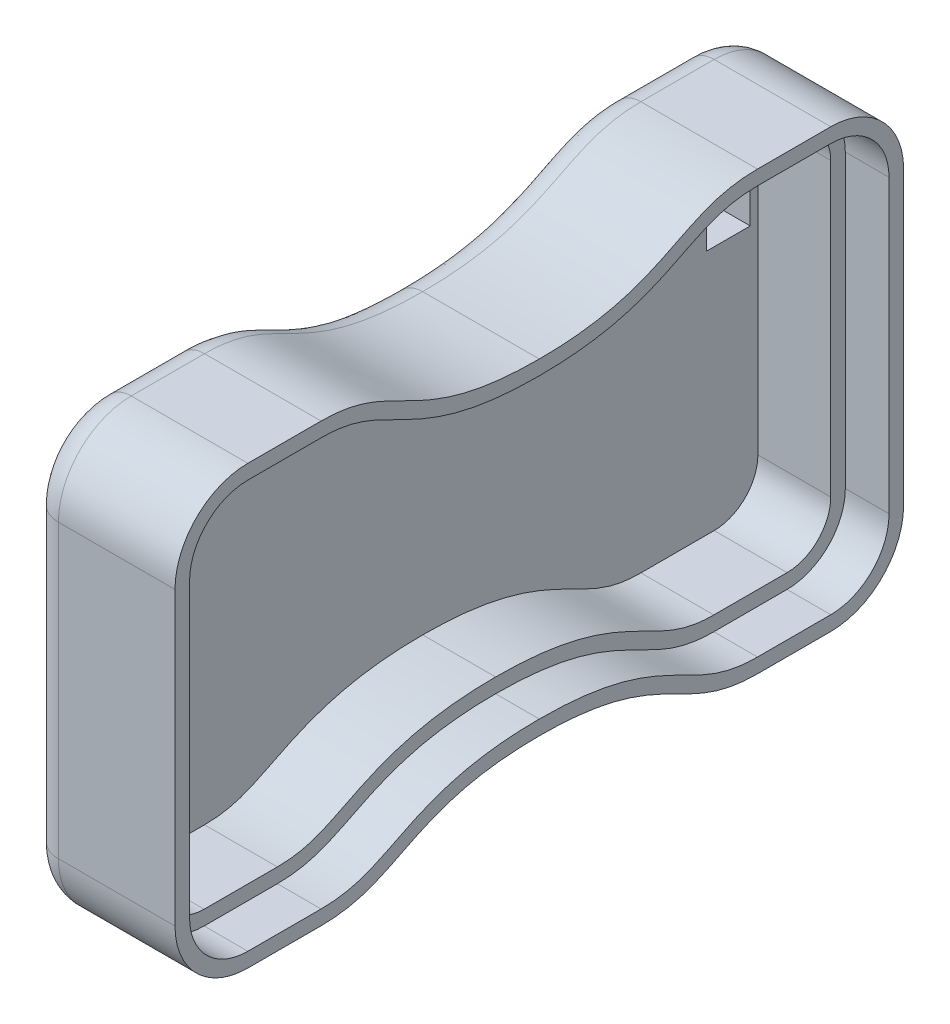
from build123d import *

# Parameters (mm, degrees)
BOSS_EXTRUDE1_DEPTH      = 10
BOSS_EXTRUDE1_DEPTH_BACK = 0.001
CUT_EXTRUDE2_DEPTH       = 8
FILLET1_R                = 2
CUT_EXTRUDE3_DEPTH       = 1
CUT_EXTRUDE4_DEPTH       = 1
CUT_EXTRUDE6_DEPTH       = 3
SKETCH9_W                = 3
SKETCH9_H                = 3
CUT_EXTRUDE7_DEPTH       = 2.5


with BuildPart() as part:
    # Sketch1 → Boss-Extrude1 (new, two sides: drawn at the far end of the back side and taken through both)
    with BuildSketch(Plane(origin=(0, 0, 0), x_dir=(0, 0, -1), z_dir=(1, 0, 0)).offset(-BOSS_EXTRUDE1_DEPTH_BACK)):
        with BuildLine():
            Line((-14.972324225, 15), (-20, 15))
            ThreePointArc((-20, 15), (-23.535533906, 13.535533906), (-25, 10))
            Line((-25, 10), (-25, -10))
            ThreePointArc((-25, -10), (-23.535533906, -13.535533906), (-20, -15))
            Line((-20, -15), (-14.972324225, -15))
            add(Edge.make_bspline(
                [(-14.972324225, -15), (-9.506561261, -15), (-8.88126456, -11.19751344), (0, -11.19751344)],
                knots=[0, 0, 0, 0, 1, 1, 1, 1], degree=3))
            add(Edge.make_bspline(
                [(14.972324225, -15), (9.506561261, -15), (8.88126456, -11.19751344), (0, -11.19751344)],
                knots=[0, 0, 0, 0, 1, 1, 1, 1], degree=3))
            Line((14.972324225, -15), (20, -15))
            ThreePointArc((20, -15), (23.535533906, -13.535533906), (25, -10))
            Line((25, -10), (25, 10))
            ThreePointArc((25, 10), (23.535533906, 13.535533906), (20, 15))
            Line((20, 15), (14.972324225, 15))
            add(Edge.make_bspline(
                [(14.972324225, 15), (9.506561261, 15), (8.88126456, 11.19751344), (0, 11.19751344)],
                knots=[0, 0, 0, 0, 1, 1, 1, 1], degree=3))
            add(Edge.make_bspline(
                [(-14.972324225, 15), (-9.506561261, 15), (-8.88126456, 11.19751344), (0, 11.19751344)],
                knots=[0, 0, 0, 0, 1, 1, 1, 1], degree=3))
        make_face()
    extrude(amount=BOSS_EXTRUDE1_DEPTH + BOSS_EXTRUDE1_DEPTH_BACK)

    # Sketch3 → Cut-Extrude2 (cut)
    with BuildSketch(Plane(origin=(10, 0, 0), x_dir=(0, 0, -1), z_dir=(1, 0, 0))):
        with BuildLine():
            add(Edge.make_bspline(
                [(14.972324225, 13), (14.708537784, 13), (14.155988905, 12.97545839), (13.256726616, 12.846515622), (12.269088092, 12.561695204), (11.07958651, 12.026997007), (9.695530175, 11.31327974), (7.999204021, 10.526216112), (6.245696406, 9.936625425), (4.598237911, 9.571117564), (3.229628717, 9.362119527), (1.962596684, 9.251295033), (0.874332841, 9.205417495), (0.28794958, 9.19751344), (0, 9.19751344)],
                knots=[0, 0, 0, 0, 0.0625, 0.125, 0.25, 0.375, 0.5, 0.625, 0.75, 0.8125, 0.875, 0.9375, 0.96875, 1, 1, 1, 1], degree=3))
            add(Edge.make_bspline(
                [(0, 9.19751344), (-0.28794958, 9.19751344), (-0.874332841, 9.205417495), (-1.962596684, 9.251295033), (-3.229628717, 9.362119527), (-4.598237911, 9.571117564), (-6.245696406, 9.936625425), (-7.999204021, 10.526216112), (-9.695530175, 11.31327974), (-11.07958651, 12.026997007), (-12.269088092, 12.561695204), (-13.256726616, 12.846515622), (-14.155988905, 12.97545839), (-14.708537784, 13), (-14.972324225, 13)],
                knots=[0, 0, 0, 0, 0.03125, 0.0625, 0.125, 0.1875, 0.25, 0.375, 0.5, 0.625, 0.75, 0.875, 0.9375, 1, 1, 1, 1], degree=3))
            Line((-14.972324225, 13), (-20, 13))
            ThreePointArc((-20, 13), (-22.121320344, 12.121320344), (-23, 10))
            Line((-23, 10), (-23, -10))
            ThreePointArc((-23, -10), (-22.121320344, -12.121320344), (-20, -13))
            Line((-20, -13), (-14.972324225, -13))
            add(Edge.make_bspline(
                [(-14.972324225, -13), (-14.708537784, -13), (-14.155988905, -12.97545839), (-13.256726616, -12.846515622), (-12.269088092, -12.561695204), (-11.07958651, -12.026997007), (-9.695530175, -11.31327974), (-7.999204021, -10.526216112), (-6.245696406, -9.936625425), (-4.598237911, -9.571117564), (-3.229628717, -9.362119527), (-1.962596684, -9.251295033), (-0.874332841, -9.205417495), (-0.28794958, -9.19751344), (0, -9.19751344)],
                knots=[0, 0, 0, 0, 0.0625, 0.125, 0.25, 0.375, 0.5, 0.625, 0.75, 0.8125, 0.875, 0.9375, 0.96875, 1, 1, 1, 1], degree=3))
            add(Edge.make_bspline(
                [(0, -9.19751344), (0.28794958, -9.19751344), (0.874332841, -9.205417495), (1.962596684, -9.251295033), (3.229628717, -9.362119527), (4.598237911, -9.571117564), (6.245696406, -9.936625425), (7.999204021, -10.526216112), (9.695530175, -11.31327974), (11.07958651, -12.026997007), (12.269088092, -12.561695204), (13.256726616, -12.846515622), (14.155988905, -12.97545839), (14.708537784, -13), (14.972324225, -13)],
                knots=[0, 0, 0, 0, 0.03125, 0.0625, 0.125, 0.1875, 0.25, 0.375, 0.5, 0.625, 0.75, 0.875, 0.9375, 1, 1, 1, 1], degree=3))
            Line((14.972324225, -13), (20, -13))
            ThreePointArc((20, -13), (22.121320344, -12.121320344), (23, -10))
            Line((23, -10), (23, 10))
            ThreePointArc((23, 10), (22.121320344, 12.121320344), (20, 13))
            Line((20, 13), (14.972324225, 13))
        make_face()
    extrude(amount=-CUT_EXTRUDE2_DEPTH, mode=Mode.SUBTRACT)

    # Fillet1
    fillet1_edges = [part.edges().sort_by_distance(p)[0] for p in [
        (-0.001, -12.578604969, 7.634044964),
        (-0.001, -12.578604969, -7.634044964),
        (-0.001, -15, -17.486162113),
        (-0.001, -13.535533906, -23.535533906),
        (-0.001, 0, -25),
        (-0.001, 13.535533906, -23.535533906),
        (-0.001, 15, -17.486162113),
        (-0.001, 12.578604969, -7.634044964),
        (-0.001, 12.578604969, 7.634044964),
        (-0.001, -15, 17.486162113),
        (-0.001, 15, 17.486162113),
        (-0.001, 13.535533906, 23.535533906),
        (-0.001, 0, 25),
        (-0.001, -13.535533906, 23.535533906),
    ]]
    fillet(fillet1_edges, radius=FILLET1_R)

    # Sketch4 → Cut-Extrude3 (cut)
    # profile 1 of 9: a face of its own
    with BuildSketch(Plane.ZY.offset(0.001)):
        Polygon((1.296715641, -1.915293303), (-1.296715641, -1.915293303), (-1.296715641, -4.98093836), (-3.185648454, -4.98093836), (0, -8.480108981), (3.185648454, -4.98093836), (1.296715641, -4.98093836), align=None)
    # profile 2 of 9: a face of its own
    with BuildSketch(Plane.ZY.offset(0.001)):
        with BuildLine():
            Line((-1.895260699, 2.552625782), (-1.895260699, 8.373459116))
            Line((-1.895260699, 8.373459116), (-0.962434844, 8.373459116))
            add(Edge.make_bspline(
                [(-0.962434844, 8.373459116), (-0.897131202, 8.373466569), (-0.770769892, 8.373480989), (-0.588463498, 8.367078987), (-0.419389715, 8.358797281), (-0.264086599, 8.349531977), (-0.122289815, 8.333566007), (0.005785013, 8.316739618), (0.120393778, 8.296448031), (0.19125015, 8.278245848), (0.224586056, 8.269682239)],
                knots=[0, 0, 0, 0, 1.311965854, 2.538629056, 3.664479157, 4.713267157, 5.663616078, 6.530575999, 7.308677837, 8, 8, 8, 8], degree=3))
            add(Edge.make_bspline(
                [(0.224586056, 8.269682239), (0.268359485, 8.257603117), (0.354257005, 8.2339), (0.477289666, 8.186030532), (0.594003307, 8.132820225), (0.704255424, 8.072117216), (0.807369025, 8.00318865), (0.902952243, 7.925487489), (0.993066572, 7.842132655), (1.074512257, 7.750801072), (1.148125737, 7.654292336), (1.212082653, 7.552631736), (1.267653016, 7.447373728), (1.312123862, 7.337193709), (1.345631809, 7.22259909), (1.370139382, 7.104079207), (1.386023607, 6.981259033), (1.387524458, 6.897700454), (1.38828631, 6.855285037)],
                knots=[0, 0, 0, 0, 1.099996261, 2.158545794, 3.195537121, 4.207578794, 5.205712374, 6.197378256, 7.190519799, 8.17788031, 9.159561366, 10.129234751, 11.085776129, 12.040971148, 13.00380137, 13.975669004, 14.972423361, 16, 16, 16, 16], degree=3))
            add(Edge.make_bspline(
                [(1.38828631, 6.855285037), (1.386294294, 6.80079236), (1.382373257, 6.693530219), (1.357325406, 6.535981541), (1.310356783, 6.387075396), (1.248899482, 6.244067498), (1.165336766, 6.107491269), (1.059228278, 5.977411647), (0.932292629, 5.849823285), (0.834925978, 5.773342669), (0.784281569, 5.733561947)],
                knots=[0, 0, 0, 0, 0.986156485, 1.941127874, 2.875419072, 3.804401753, 4.751181392, 5.761612777, 6.835722519, 8, 8, 8, 8], degree=3))
            add(Edge.make_bspline(
                [(0.784281569, 5.733561947), (0.825321368, 5.712611485), (0.905789061, 5.671533426), (1.020029545, 5.604013359), (1.125803763, 5.532197204), (1.223585974, 5.457529931), (1.311325085, 5.376846287), (1.39264399, 5.294795374), (1.463530838, 5.206676016), (1.526919994, 5.115628954), (1.582016817, 5.020335816), (1.630000075, 4.920957532), (1.670529812, 4.817154602), (1.704851441, 4.709455301), (1.730448522, 4.597489193), (1.747138363, 4.481216234), (1.759917148, 4.361032974), (1.760911217, 4.279167138), (1.761416651, 4.237542482)],
                knots=[0, 0, 0, 0, 1.164658916, 2.283573913, 3.35186032, 4.395461096, 5.390182219, 6.362969632, 7.312859996, 8.245001507, 9.165155236, 10.092416118, 11.032087915, 11.979892451, 12.947605196, 13.931445124, 14.948243989, 16, 16, 16, 16], degree=3))
            add(Edge.make_bspline(
                [(1.761416651, 4.237542482), (1.758136721, 4.15804177), (1.751663792, 4.001147433), (1.704336889, 3.770790512), (1.622287079, 3.552391258), (1.512111103, 3.346817683), (1.376353103, 3.160020804), (1.220270334, 2.99638836), (1.045434191, 2.857877128), (0.884126717, 2.764392792), (0.744608456, 2.701656061), (0.629048086, 2.662868257), (0.504938699, 2.626935295), (0.370006908, 2.601702426), (0.226698843, 2.578606531), (0.073617241, 2.564346646), (-0.088951792, 2.554683074), (-0.200611231, 2.553325411), (-0.258151324, 2.552625782)],
                knots=[0, 0, 0, 0, 1.284142165, 2.534249414, 3.780121997, 5.041676246, 6.291546858, 7.49970053, 8.684500223, 9.883330709, 10.50184324, 11.153274765, 11.851151195, 12.587658647, 13.369265475, 14.195992086, 15.070362669, 16, 16, 16, 16], degree=3))
            Line((-0.258151324, 2.552625782), (-1.895260699, 2.552625782))
        make_face()
        with BuildLine():
            Line((-0.850495742, 7.328694159), (-0.850495742, 6.060050996))
            Line((-0.850495742, 6.060050996), (-0.57298005, 6.060050996))
            add(Edge.make_bspline(
                [(-0.57298005, 6.060050996), (-0.535263174, 6.060379902), (-0.462453028, 6.061014834), (-0.357286495, 6.069192538), (-0.259498603, 6.083144209), (-0.16946024, 6.102610299), (-0.086332667, 6.127329396), (-0.010646926, 6.157071793), (0.057264206, 6.193360751), (0.136161234, 6.247414754), (0.219561083, 6.32695764), (0.292977032, 6.44187382), (0.336218535, 6.574026989), (0.341034472, 6.667231637), (0.343521352, 6.715361159)],
                knots=[0, 0, 0, 0, 1.065314748, 2.056525647, 2.977365736, 3.853934255, 4.656397591, 5.425096493, 6.14721249, 6.826394842, 8.123232004, 9.372140726, 10.643011755, 12, 12, 12, 12], degree=3))
            add(Edge.make_bspline(
                [(0.343521352, 6.715361159), (0.341531393, 6.760442453), (0.337683887, 6.847605324), (0.294145253, 6.969989757), (0.226521146, 7.078447412), (0.146681383, 7.152677808), (0.071496732, 7.203374979), (0.00711902, 7.236756908), (-0.063540352, 7.266640069), (-0.141849276, 7.289489462), (-0.227360564, 7.306634843), (-0.319658839, 7.319226071), (-0.418903349, 7.327796197), (-0.487451743, 7.328388418), (-0.52284066, 7.328694159)],
                knots=[0, 0, 0, 0, 1.347982417, 2.606269829, 3.849316587, 5.153353503, 5.842674298, 6.568177932, 7.326619318, 8.142485038, 9.012069166, 9.942760135, 10.937925643, 12, 12, 12, 12], degree=3))
            Line((-0.52284066, 7.328694159), (-0.850495742, 7.328694159))
        make_face(mode=Mode.SUBTRACT)
        with BuildLine():
            Line((-0.850495742, 5.089912107), (-0.850495742, 3.59739074))
            Line((-0.850495742, 3.59739074), (-0.549659404, 3.59739074))
            add(Edge.make_bspline(
                [(-0.549659404, 3.59739074), (-0.490183677, 3.597730522), (-0.37583417, 3.598383797), (-0.212028703, 3.606276906), (-0.063088583, 3.620502845), (0.070591556, 3.638262783), (0.18921647, 3.662324722), (0.292385179, 3.692916394), (0.381512507, 3.726572561), (0.456064044, 3.768141923), (0.516968378, 3.816518353), (0.571928155, 3.865960226), (0.616738932, 3.922996097), (0.652194055, 3.985177575), (0.682880401, 4.050960028), (0.701388238, 4.122912235), (0.715479456, 4.198901706), (0.716254933, 4.25146198), (0.716651694, 4.278353614)],
                knots=[0, 0, 0, 0, 1.753078804, 3.370512758, 4.83203934, 6.162291463, 7.344201807, 8.395507345, 9.331626367, 10.147333109, 10.898971645, 11.62040215, 12.321813352, 13.025280112, 13.727906689, 14.453419512, 15.208716525, 16, 16, 16, 16], degree=3))
            add(Edge.make_bspline(
                [(0.716651694, 4.278353614), (0.715776723, 4.30910462), (0.714072514, 4.368999308), (0.700154219, 4.456541786), (0.674860132, 4.538268498), (0.643000995, 4.616269306), (0.598667312, 4.687751509), (0.545978246, 4.755188835), (0.482316403, 4.816297649), (0.410724947, 4.874774039), (0.327220601, 4.925973287), (0.231764188, 4.970397703), (0.123837136, 5.00749934), (0.00310513, 5.037039688), (-0.12990255, 5.062110172), (-0.276156714, 5.077080019), (-0.434439307, 5.088213752), (-0.544195032, 5.089333125), (-0.600964826, 5.089912107)],
                knots=[0, 0, 0, 0, 0.845221588, 1.646264278, 2.427170338, 3.19324141, 3.95557735, 4.731569926, 5.540061037, 6.376114724, 7.268642756, 8.224665384, 9.265483498, 10.400594375, 11.639216012, 12.983232105, 14.439614077, 16, 16, 16, 16], degree=3))
            Line((-0.600964826, 5.089912107), (-0.850495742, 5.089912107))
        make_face(mode=Mode.SUBTRACT)
    # profile 3 of 9: a face of its own
    with BuildSketch(Plane.ZY.offset(0.001)):
        Polygon((2.806181609, 8.373459116), (5.94047648, 8.373459116), (5.94047648, 7.328694159), (3.850946566, 7.328694159), (3.850946566, 6.209303133), (5.94047648, 6.209303133), (5.94047648, 5.164538176), (3.850946566, 5.164538176), (3.850946566, 3.59739074), (5.94047648, 3.59739074), (5.94047648, 2.552625782), (2.806181609, 2.552625782), align=None)
    # profile 4 of 9: a face of its own
    with BuildSketch(Plane.ZY.offset(0.001)):
        Polygon((8.777433111, 8.373459116), (9.746405968, 8.373459116), (12.097127122, 2.552625782), (10.981234193, 2.552625782), (10.528813653, 3.746642876), (7.992693361, 3.746642876), (7.540272821, 2.552625782), (6.425545925, 2.552625782), align=None)
        Polygon((9.261336523, 6.812141841), (8.389144349, 4.791407834), (10.133528697, 4.791407834), align=None, mode=Mode.SUBTRACT)
    # profile 5 of 9: a face of its own
    with BuildSketch(Plane.ZY.offset(0.001)):
        with BuildLine():
            Line((15.940369643, 7.595715559), (15.15912799, 6.880937748))
            add(Edge.make_bspline(
                [(15.15912799, 6.880937748), (15.125662947, 6.92814367), (15.061414732, 7.018772456), (14.957275077, 7.140126537), (14.853605666, 7.243650599), (14.749446065, 7.328912167), (14.643873043, 7.395393212), (14.537069859, 7.442462527), (14.42964201, 7.472384937), (14.357467078, 7.476110997), (14.321916785, 7.477946295)],
                knots=[0, 0, 0, 0, 1.299362458, 2.494594718, 3.587462134, 4.587049575, 5.512617175, 6.380583204, 7.202344345, 8, 8, 8, 8], degree=3))
            add(Edge.make_bspline(
                [(14.321916785, 7.477946295), (14.288756491, 7.476783366), (14.224732676, 7.474538055), (14.133461977, 7.452219835), (14.052430551, 7.413701863), (13.981717481, 7.363336375), (13.925702296, 7.302657639), (13.880978515, 7.239021246), (13.855795268, 7.16878106), (13.852480657, 7.120537267), (13.850839728, 7.096653727)],
                knots=[0, 0, 0, 0, 1.185010067, 2.2879431, 3.333075148, 4.379039566, 5.372662701, 6.27520591, 7.14612461, 8, 8, 8, 8], degree=3))
            add(Edge.make_bspline(
                [(13.850839728, 7.096653727), (13.851868015, 7.072425776), (13.853938842, 7.023634051), (13.873940213, 6.9521237), (13.904087991, 6.882249763), (13.932895423, 6.839714173), (13.947620411, 6.817972003)],
                knots=[0, 0, 0, 0, 0.967525499, 1.948461899, 2.951351359, 4, 4, 4, 4], degree=3))
            add(Edge.make_bspline(
                [(13.947620411, 6.817972003), (13.961007018, 6.801072042), (13.99182122, 6.762170564), (14.050577591, 6.700556687), (14.124363254, 6.625074295), (14.216017636, 6.538319005), (14.321735912, 6.437170759), (14.446418259, 6.325605732), (14.586475777, 6.200168885), (14.686025416, 6.112819207), (14.738190323, 6.06704719)],
                knots=[0, 0, 0, 0, 0.473873513, 1.090794244, 1.870441696, 2.795289791, 3.865433203, 5.087734844, 6.473946851, 8, 8, 8, 8], degree=3))
            add(Edge.make_bspline(
                [(14.738190323, 6.06704719), (14.787154591, 6.024671085), (14.880078601, 5.944250042), (15.012291013, 5.830105284), (15.128483703, 5.727412029), (15.230349335, 5.637711482), (15.316343723, 5.560062479), (15.386828389, 5.494093859), (15.442664184, 5.44108991), (15.474403564, 5.409075493), (15.487949103, 5.395412575)],
                knots=[0, 0, 0, 0, 1.543621617, 2.929473131, 4.163658386, 5.240097082, 6.164993805, 6.925417477, 7.541396219, 8, 8, 8, 8], degree=3))
            add(Edge.make_bspline(
                [(15.487949103, 5.395412575), (15.539338055, 5.339798723), (15.638125668, 5.232889369), (15.766514739, 5.067213493), (15.872183097, 4.905480056), (15.953930143, 4.744645781), (16.0156688, 4.58239015), (16.059195371, 4.414733851), (16.085263724, 4.239924983), (16.08815792, 4.12063927), (16.08962178, 4.06030557)],
                knots=[0, 0, 0, 0, 1.206664779, 2.319633467, 3.337109185, 4.282041471, 5.190008762, 6.099243693, 7.03861361, 8, 8, 8, 8], degree=3))
            add(Edge.make_bspline(
                [(16.08962178, 4.06030557), (16.088579842, 4.001517779), (16.086535521, 3.886173944), (16.061496512, 3.717385423), (16.025792354, 3.555847483), (15.970587463, 3.403317885), (15.903304069, 3.257292903), (15.818954617, 3.12004714), (15.719897751, 2.990191614), (15.606363373, 2.870047652), (15.48078087, 2.761025333), (15.3460817, 2.66397109), (15.200948707, 2.58384045), (15.046621885, 2.517858583), (14.883183841, 2.467038468), (14.710829278, 2.429477666), (14.52929457, 2.406934264), (14.405158521, 2.404577619), (14.341739334, 2.403373646)],
                knots=[0, 0, 0, 0, 1.043214005, 2.046824704, 3.02475056, 3.976699089, 4.921714032, 5.875962561, 6.831408892, 7.817874052, 8.806269674, 9.781291748, 10.760897367, 11.74438705, 12.757449933, 13.795994037, 14.874007457, 16, 16, 16, 16], degree=3))
            add(Edge.make_bspline(
                [(14.341739334, 2.403373646), (14.291955813, 2.404256839), (14.193355889, 2.406006067), (14.048034509, 2.42028706), (13.907710288, 2.443335064), (13.77254129, 2.476369738), (13.641918554, 2.518229151), (13.515836716, 2.569358821), (13.395166161, 2.630551237), (13.278993838, 2.700548042), (13.167884488, 2.781823552), (13.060433177, 2.872716116), (12.957707214, 2.974623704), (12.859213226, 3.087305307), (12.765581405, 3.211080012), (12.673746846, 3.344224028), (12.587790953, 3.489208327), (12.534692175, 3.590915986), (12.507570498, 3.642866)],
                knots=[0, 0, 0, 0, 1.016823716, 2.013894106, 2.979844003, 3.91962641, 4.853723003, 5.779685073, 6.695824784, 7.614987388, 8.547259901, 9.504950863, 10.487499108, 11.500346958, 12.559593716, 13.656357062, 14.802919212, 16, 16, 16, 16], degree=3))
            Line((12.507570498, 3.642866), (13.426403964, 4.194399287))
            add(Edge.make_bspline(
                [(13.426403964, 4.194399287), (13.460329129, 4.135429233), (13.52536657, 4.0223786), (13.635578593, 3.870480746), (13.748485184, 3.740405377), (13.866696642, 3.634451585), (13.98877556, 3.551202631), (14.115311609, 3.491707153), (14.246393688, 3.454879519), (14.335680846, 3.450382015), (14.380218401, 3.448138603)],
                knots=[0, 0, 0, 0, 1.283663364, 2.460892379, 3.537111102, 4.529833553, 5.449777664, 6.316464042, 7.160231139, 8, 8, 8, 8], degree=3))
            add(Edge.make_bspline(
                [(14.380218401, 3.448138603), (14.42551947, 3.449970695), (14.513410143, 3.453525219), (14.63886283, 3.486357292), (14.753882605, 3.537906056), (14.853304848, 3.611459032), (14.937489335, 3.696350347), (14.999622319, 3.790795815), (15.038654679, 3.892983533), (15.042781345, 3.963969843), (15.044856822, 3.99967189)],
                knots=[0, 0, 0, 0, 1.13588714, 2.203786484, 3.234766741, 4.283437687, 5.291419208, 6.222934724, 7.106237994, 8, 8, 8, 8], degree=3))
            add(Edge.make_bspline(
                [(15.044856822, 3.99967189), (15.042940204, 4.032886834), (15.039046778, 4.100359814), (15.010369003, 4.200681285), (14.965536893, 4.300957132), (14.912497345, 4.383206095), (14.858522964, 4.452070922), (14.806911282, 4.511739179), (14.744061906, 4.577662158), (14.670134194, 4.649922783), (14.586104925, 4.729157184), (14.491903314, 4.815357602), (14.386450654, 4.907764715), (14.311916506, 4.970711527), (14.272943428, 5.003625716)],
                knots=[0, 0, 0, 0, 0.916159276, 1.861089862, 2.860218735, 3.940849679, 4.552606315, 5.27541173, 6.11797699, 7.06649574, 8.129236253, 9.306560635, 10.591630461, 12, 12, 12, 12], degree=3))
            add(Edge.make_bspline(
                [(14.272943428, 5.003625716), (14.198854054, 5.06631243), (14.056654121, 5.186627209), (13.855707575, 5.36432835), (13.674636744, 5.530406349), (13.515005551, 5.686914293), (13.374780048, 5.830961843), (13.254909901, 5.963719008), (13.156711941, 6.086209829), (13.053379761, 6.231292009), (12.955193531, 6.408084613), (12.870332765, 6.620786612), (12.815278682, 6.833461622), (12.809110637, 6.97623991), (12.806074771, 7.046514337)],
                knots=[0, 0, 0, 0, 1.345494975, 2.582412109, 3.71882943, 4.751509156, 5.681369928, 6.505683931, 7.230279997, 7.856715994, 8.973648664, 10.023341002, 11.027102913, 12, 12, 12, 12], degree=3))
            add(Edge.make_bspline(
                [(12.806074771, 7.046514337), (12.807337384, 7.09634919), (12.809824867, 7.194529202), (12.832013596, 7.338888605), (12.865175498, 7.478183299), (12.913336099, 7.611905074), (12.975842745, 7.739886438), (13.051754638, 7.862753914), (13.142250547, 7.979376656), (13.244233326, 8.089677353), (13.356592239, 8.190479638), (13.476662016, 8.279447755), (13.603763052, 8.35459152), (13.737117807, 8.41692873), (13.877552624, 8.464643904), (14.024032928, 8.498466797), (14.176768817, 8.518583576), (14.280656471, 8.521318219), (14.333577108, 8.522711253)],
                knots=[0, 0, 0, 0, 1.010766082, 1.991317756, 2.957454644, 3.913069143, 4.869106762, 5.843196583, 6.838735724, 7.860187025, 8.887984031, 9.89767229, 10.887916223, 11.879572884, 12.879850636, 13.892031539, 14.926195476, 16, 16, 16, 16], degree=3))
            add(Edge.make_bspline(
                [(14.333577108, 8.522711253), (14.402159634, 8.520202358), (14.53878332, 8.515204372), (14.740785381, 8.476121759), (14.938092547, 8.414660232), (15.09708636, 8.340513662), (15.223594769, 8.268687845), (15.320551647, 8.20255968), (15.419210489, 8.126806313), (15.520366918, 8.041189025), (15.62214129, 7.944094674), (15.727427538, 7.837834667), (15.834791008, 7.72149067), (15.90456024, 7.638375058), (15.940369643, 7.595715559)],
                knots=[0, 0, 0, 0, 1.282922637, 2.555718331, 3.837320111, 5.142675274, 5.830281639, 6.55870424, 7.337177975, 8.157850921, 9.037902056, 9.96903443, 10.957596896, 12, 12, 12, 12], degree=3))
        make_face()
    # profile 6 of 9: a face of its own
    with BuildSketch(Plane.ZY.offset(0.001)):
        Polygon((16.53737819, 8.373459116), (19.671673062, 8.373459116), (19.671673062, 7.328694159), (18.626908104, 7.328694159), (18.626908104, 2.552625782), (17.582143147, 2.552625782), (17.582143147, 7.328694159), (16.53737819, 7.328694159), align=None)
    # profile 7 of 9: a face of its own
    with BuildSketch(Plane.ZY.offset(0.001)):
        with BuildLine():
            Line((7.955380327, -3.671199004), (7.955380327, -4.150438287))
            add(Edge.make_bspline(
                [(7.955380327, -4.150438287), (8.003884173, -4.10587383), (8.099140722, -4.018353835), (8.255101462, -3.906302117), (8.415374665, -3.810067078), (8.582905182, -3.73266326), (8.755393879, -3.671675179), (8.934386355, -3.628822174), (9.11856665, -3.600559468), (9.2437411, -3.597908605), (9.306811784, -3.596572936)],
                knots=[0, 0, 0, 0, 1.054376801, 2.070687235, 3.070225973, 4.045259405, 5.022040922, 5.996139433, 6.99033025, 8, 8, 8, 8], degree=3))
            add(Edge.make_bspline(
                [(9.306811784, -3.596572936), (9.37532633, -3.598214032), (9.510277755, -3.601446459), (9.7088331, -3.631625807), (9.899112546, -3.680408647), (10.081841678, -3.748522787), (10.256046937, -3.836957622), (10.423685642, -3.942841639), (10.581866668, -4.070544195), (10.73066691, -4.215188751), (10.86831084, -4.373729929), (10.988035711, -4.546097839), (11.087761882, -4.730023786), (11.172284712, -4.923333384), (11.233972869, -5.129232606), (11.281516952, -5.344959453), (11.308011184, -5.57233902), (11.311682051, -5.727238668), (11.313553404, -5.806204179)],
                knots=[0, 0, 0, 0, 0.985987466, 1.942075377, 2.884088208, 3.810275091, 4.743821533, 5.692411115, 6.659945104, 7.665215984, 8.677116751, 9.678438675, 10.680260931, 11.685531812, 12.710472044, 13.769734641, 14.863044265, 16, 16, 16, 16], degree=3))
            add(Edge.make_bspline(
                [(11.313553404, -5.806204179), (11.311782293, -5.88246649), (11.308291043, -6.03279632), (11.280083947, -6.25349288), (11.232275282, -6.464320659), (11.165209413, -6.665355584), (11.079950626, -6.857232961), (10.975886391, -7.039820574), (10.852409679, -7.21248065), (10.711243934, -7.372887283), (10.556999843, -7.518147413), (10.396288556, -7.648474631), (10.225909233, -7.755267565), (10.050120976, -7.84546238), (9.866154454, -7.91443261), (9.675266239, -7.962754008), (9.477758651, -7.99505986), (9.343477548, -7.998012489), (9.275328911, -7.99951097)],
                knots=[0, 0, 0, 0, 1.098553145, 2.165490463, 3.199345634, 4.208780719, 5.21409072, 6.219899742, 7.23156933, 8.267303578, 9.293302409, 10.281606823, 11.243293419, 12.184993323, 13.124258899, 14.066907486, 15.018941492, 16, 16, 16, 16], degree=3))
            add(Edge.make_bspline(
                [(9.275328911, -7.99951097), (9.214600589, -7.998038188), (9.094969449, -7.995136895), (8.919054642, -7.969268192), (8.74911894, -7.930629142), (8.584937554, -7.872473064), (8.424664791, -7.795300438), (8.265571006, -7.699195886), (8.107288316, -7.581787816), (8.00710273, -7.491230989), (7.955380327, -7.444479586)],
                knots=[0, 0, 0, 0, 0.990856396, 1.951927477, 2.896945079, 3.83213376, 4.788585491, 5.796263726, 6.862286081, 8, 8, 8, 8], degree=3))
            Line((7.955380327, -7.444479586), (7.955380327, -9.492032337))
            Line((7.955380327, -9.492032337), (6.910615369, -9.492032337))
            Line((6.910615369, -9.492032337), (6.910615369, -3.671199004))
            Line((6.910615369, -3.671199004), (7.955380327, -3.671199004))
        make_face()
        with BuildLine():
            add(Edge.make_bspline(
                [(9.080601514, -4.566711824), (9.038201835, -4.568015644), (8.955075415, -4.570571838), (8.833030691, -4.585221378), (8.717391166, -4.612784594), (8.606398635, -4.648509344), (8.501458582, -4.696732146), (8.40171248, -4.755188095), (8.308014662, -4.824892351), (8.21987884, -4.903084713), (8.140681797, -4.991051267), (8.070322095, -5.085048093), (8.011949349, -5.186299205), (7.963289303, -5.293520753), (7.926577425, -5.407872862), (7.899347847, -5.528382737), (7.884550297, -5.655419687), (7.882039617, -5.742037213), (7.880754258, -5.786381629)],
                knots=[0, 0, 0, 0, 1.060469436, 2.079096586, 3.066888298, 4.028858836, 4.99004353, 5.948472697, 6.914558426, 7.905691313, 8.889602648, 9.869280844, 10.836099585, 11.806137001, 12.808075328, 13.83377171, 14.890985086, 16, 16, 16, 16], degree=3))
            add(Edge.make_bspline(
                [(7.880754258, -5.786381629), (7.882055791, -5.831502109), (7.884610105, -5.920052993), (7.899284298, -6.049798835), (7.926322752, -6.17272308), (7.963807852, -6.289104427), (8.011639882, -6.398957975), (8.069943467, -6.502690969), (8.141077648, -6.598029116), (8.219404682, -6.688314969), (8.308085469, -6.767553561), (8.401361176, -6.838619678), (8.501434349, -6.897162762), (8.606875914, -6.944596498), (8.716885789, -6.984013673), (8.833103331, -7.010647818), (8.95505614, -7.02556904), (9.038195324, -7.028087506), (9.080601514, -7.029372081)],
                knots=[0, 0, 0, 0, 1.117193555, 2.192540452, 3.22680955, 4.227918444, 5.21468246, 6.188555072, 7.166222992, 8.154674427, 9.142376254, 10.104580718, 11.053462639, 12.005072638, 12.963662044, 13.941614018, 14.950094269, 16, 16, 16, 16], degree=3))
            add(Edge.make_bspline(
                [(9.080601514, -7.029372081), (9.121465191, -7.02817875), (9.202351832, -7.025816638), (9.320702691, -7.009334656), (9.434467351, -6.982401459), (9.542754886, -6.944011909), (9.646224484, -6.894028755), (9.745818103, -6.835540192), (9.838097395, -6.762463099), (9.926682632, -6.682145135), (10.005942753, -6.591569572), (10.077048607, -6.495344965), (10.136779638, -6.392612491), (10.184204668, -6.283031474), (10.223412293, -6.168677537), (10.250180576, -6.047457608), (10.264907994, -5.920453662), (10.267482112, -5.833836786), (10.268788446, -5.789879726)],
                knots=[0, 0, 0, 0, 1.021711385, 2.02240246, 2.981887075, 3.941027022, 4.888772411, 5.852236371, 6.822344989, 7.82661704, 8.838806642, 9.826383926, 10.814965113, 11.80282933, 12.807900643, 13.833672313, 14.900613836, 16, 16, 16, 16], degree=3))
            add(Edge.make_bspline(
                [(10.268788446, -5.789879726), (10.26746125, -5.746318132), (10.264846302, -5.660489596), (10.250420469, -5.534543252), (10.222621568, -5.415085652), (10.187521915, -5.301140915), (10.138484555, -5.194192304), (10.080502821, -5.092974634), (10.012276568, -4.997182286), (9.933131175, -4.909401185), (9.846322629, -4.829526689), (9.753655984, -4.758877038), (9.655495151, -4.698734056), (9.550503395, -4.651304502), (9.441158355, -4.612280201), (9.325789011, -4.585399747), (9.204981889, -4.5705226), (9.122618485, -4.567999143), (9.080601514, -4.566711824)],
                knots=[0, 0, 0, 0, 1.094680664, 2.156827393, 3.177782763, 4.17210342, 5.146667393, 6.126451192, 7.099203661, 8.094961544, 9.09004898, 10.058676268, 11.018205477, 11.974998356, 12.947750825, 13.930643515, 14.944335875, 16, 16, 16, 16], degree=3))
        make_face(mode=Mode.SUBTRACT)
    # profile 8 of 9: a face of its own
    with BuildSketch(Plane.ZY.offset(0.001)):
        with BuildLine():
            Line((12.059814087, -3.671199004), (12.955326908, -3.671199004))
            Line((12.955326908, -3.671199004), (12.955326908, -4.194747515))
            add(Edge.make_bspline(
                [(12.955326908, -4.194747515), (12.980659246, -4.148219615), (13.030172353, -4.057278903), (13.121132082, -3.935209008), (13.225630304, -3.832405148), (13.339912073, -3.746717086), (13.464323755, -3.679931656), (13.595533827, -3.632338618), (13.73241979, -3.601409738), (13.825798753, -3.598196812), (13.872994342, -3.596572936)],
                knots=[0, 0, 0, 0, 1.09866127, 2.147379032, 3.14564304, 4.131443017, 5.102343063, 6.064490016, 7.021754664, 8, 8, 8, 8], degree=3))
            add(Edge.make_bspline(
                [(13.872994342, -3.596572936), (13.90726423, -3.598177665), (13.977049957, -3.601445467), (14.083413226, -3.620441251), (14.191311129, -3.654789241), (14.262317248, -3.685715041), (14.298596139, -3.701515844)],
                knots=[0, 0, 0, 0, 0.931404136, 1.896671404, 2.925354185, 4, 4, 4, 4], degree=3))
            Line((14.298596139, -3.701515844), (13.974439154, -4.586534374))
            add(Edge.make_bspline(
                [(13.974439154, -4.586534374), (13.945464149, -4.572535052), (13.891002292, -4.546221716), (13.811933134, -4.515169269), (13.740174594, -4.496222584), (13.694680996, -4.493395572), (13.673602816, -4.492085756)],
                knots=[0, 0, 0, 0, 1.214386998, 2.282580073, 3.20428172, 4, 4, 4, 4], degree=3))
            add(Edge.make_bspline(
                [(13.673602816, -4.492085756), (13.653700915, -4.49295371), (13.614550446, -4.494661124), (13.556765449, -4.509293083), (13.502344015, -4.534525443), (13.448663578, -4.566850601), (13.39995893, -4.611784988), (13.351284365, -4.663804519), (13.308389732, -4.728029549), (13.263123455, -4.799515269), (13.224580838, -4.887013727), (13.191531731, -4.991468854), (13.162084711, -5.114089267), (13.141821141, -5.255526023), (13.122235587, -5.414410474), (13.110577784, -5.591908815), (13.101889077, -5.787459778), (13.10135782, -5.923961407), (13.101080948, -5.995101414)],
                knots=[0, 0, 0, 0, 0.544232178, 1.070598461, 1.618251235, 2.182094276, 2.777567932, 3.425210017, 4.127676488, 4.886675562, 5.738955394, 6.734782583, 7.883056018, 9.186093582, 10.642914445, 12.264202625, 14.053029461, 16, 16, 16, 16], degree=3))
            Line((13.101080948, -5.995101414), (13.104579045, -6.202655167))
            Line((13.104579045, -6.202655167), (13.104579045, -7.924884901))
            Line((13.104579045, -7.924884901), (12.059814087, -7.924884901))
            Line((12.059814087, -7.924884901), (12.059814087, -3.671199004))
        make_face()
    # profile 9 of 9: a face of its own
    with BuildSketch(Plane.ZY.offset(0.001)):
        with BuildLine():
            add(Edge.make_bspline(
                [(16.847542787, -3.596572936), (16.896937257, -3.597451944), (16.99476069, -3.599192779), (17.140456472, -3.61368364), (17.283605157, -3.637326077), (17.425029542, -3.667938906), (17.563416372, -3.710832059), (17.699491467, -3.762275763), (17.834471513, -3.821339152), (17.965006331, -3.891645243), (18.092038938, -3.967898611), (18.212473409, -4.052012332), (18.32530962, -4.143325722), (18.432642194, -4.239721609), (18.529469261, -4.345396753), (18.621978589, -4.455259285), (18.705172125, -4.573245194), (18.782197355, -4.696479437), (18.850772364, -4.824249375), (18.910317147, -4.955666194), (18.96199642, -5.088912964), (19.002460256, -5.225612722), (19.035960582, -5.3639629), (19.057101669, -5.505658876), (19.072131516, -5.649245075), (19.073816838, -5.745919121), (19.074664515, -5.794543856)],
                knots=[0, 0, 0, 0, 1.022364134, 2.024744242, 3.027414945, 4.024939316, 5.017584196, 6.023349371, 7.035562955, 8.064994934, 9.090267829, 10.101425541, 11.102933353, 12.093946398, 13.084502048, 14.067315274, 15.065326281, 16.070028806, 17.074376865, 18.064572984, 19.055292013, 20.030201733, 21.013838017, 21.999348303, 22.993720005, 24, 24, 24, 24], degree=3))
            add(Edge.make_bspline(
                [(19.074664515, -5.794543856), (19.073769932, -5.843548471), (19.0719913, -5.940980756), (19.05764543, -6.085917561), (19.033912497, -6.228279867), (19.003182175, -6.368906354), (18.96044954, -6.505997571), (18.910521018, -6.641574297), (18.849231793, -6.773788571), (18.781472039, -6.904082726), (18.703951569, -7.028622603), (18.620830047, -7.147790446), (18.528708193, -7.258459924), (18.432656254, -7.364063204), (18.328118268, -7.461029257), (18.216762858, -7.550932552), (18.099554051, -7.634872198), (17.975648993, -7.710878812), (17.8466347, -7.777663113), (17.714686974, -7.837874611), (17.579034259, -7.888004982), (17.439957295, -7.928884919), (17.297371737, -7.960537231), (17.151592377, -7.982039023), (17.002933168, -7.996993271), (16.902772447, -7.998666334), (16.852206916, -7.99951097)],
                knots=[0, 0, 0, 0, 1.012026251, 2.012137606, 3.004615893, 3.992048833, 4.982446996, 5.968083444, 6.973977695, 7.990229942, 8.999482246, 10.001782172, 10.988562221, 11.971415814, 12.948383116, 13.930088534, 14.925840678, 15.924049238, 16.929462851, 17.924729459, 18.917889337, 19.913673841, 20.916777188, 21.931792057, 22.95587778, 24, 24, 24, 24], degree=3))
            add(Edge.make_bspline(
                [(16.852206916, -7.99951097), (16.778269798, -7.997340769), (16.632538612, -7.993063272), (16.41791103, -7.963763532), (16.211724773, -7.913330998), (16.013643864, -7.843029157), (15.82341099, -7.752939968), (15.642686352, -7.641440915), (15.469672233, -7.510727097), (15.307365367, -7.361903316), (15.15867029, -7.198630153), (15.02876725, -7.024337046), (14.918469057, -6.841636356), (14.827874945, -6.650319743), (14.757954765, -6.450124859), (14.707460465, -6.241650219), (14.678124903, -6.024309829), (14.673883583, -5.876642498), (14.67172648, -5.80154005)],
                knots=[0, 0, 0, 0, 1.029999031, 2.030143771, 3.011211297, 3.982305373, 4.953580601, 5.938004764, 6.935448627, 7.970290061, 9.001484052, 10.007591832, 10.993831261, 11.969999897, 12.951306496, 13.942897864, 14.953773953, 16, 16, 16, 16], degree=3))
            add(Edge.make_bspline(
                [(14.67172648, -5.80154005), (14.673958807, -5.721347098), (14.678346401, -5.563729457), (14.713185826, -5.332816021), (14.76882063, -5.111727349), (14.848680886, -4.901081897), (14.95069534, -4.700491158), (15.075231868, -4.510378199), (15.222905938, -4.330699958), (15.335994705, -4.222024398), (15.393500486, -4.166762739)],
                knots=[0, 0, 0, 0, 1.043912699, 2.05178951, 3.033892, 4.007821512, 4.978932272, 5.95884105, 6.962068106, 8, 8, 8, 8], degree=3))
            add(Edge.make_bspline(
                [(15.393500486, -4.166762739), (15.446267787, -4.12095704), (15.55036675, -4.030591877), (15.719493302, -3.915978483), (15.892659808, -3.816987478), (16.071941741, -3.73559846), (16.257838894, -3.674232453), (16.44939865, -3.629563491), (16.646581175, -3.602126505), (16.780215162, -3.598433533), (16.847542787, -3.596572936)],
                knots=[0, 0, 0, 0, 1.048115528, 2.067714963, 3.060638214, 4.039924844, 5.017819947, 5.994373833, 6.98952318, 8, 8, 8, 8], degree=3))
        make_face()
        with BuildLine():
            add(Edge.make_bspline(
                [(16.870863433, -4.566711824), (16.830413001, -4.568056263), (16.75078589, -4.570702804), (16.63357269, -4.584906085), (16.522711212, -4.614016929), (16.415999539, -4.651037956), (16.315325412, -4.700548363), (16.217931724, -4.758486949), (16.128882733, -4.83098996), (16.043869074, -4.910520458), (15.966695622, -4.998836942), (15.900936512, -5.095057686), (15.84217929, -5.195501484), (15.797626669, -5.303845711), (15.760755115, -5.417129003), (15.73580089, -5.537181675), (15.718434492, -5.662662672), (15.717145283, -5.748618015), (15.716491438, -5.792211791)],
                knots=[0, 0, 0, 0, 1.030650113, 2.02884584, 2.99876339, 3.944280128, 4.900564847, 5.851248946, 6.823638398, 7.81794922, 8.81432732, 9.802856497, 10.78262424, 11.771747962, 12.779760563, 13.812642396, 14.89064281, 16, 16, 16, 16], degree=3))
            add(Edge.make_bspline(
                [(15.716491438, -5.792211791), (15.717256526, -5.837342903), (15.718751743, -5.925542995), (15.73423503, -6.05432699), (15.75976748, -6.176542147), (15.796041091, -6.291999671), (15.841661281, -6.401528301), (15.897631963, -6.504513509), (15.964543847, -6.600336083), (16.040405682, -6.688878025), (16.123471152, -6.769248526), (16.2144878, -6.838219482), (16.309644192, -6.898146089), (16.411133246, -6.946276404), (16.517513529, -6.983436912), (16.629100839, -7.010796944), (16.746481567, -7.025537203), (16.826516672, -7.028076211), (16.867365336, -7.029372081)],
                knots=[0, 0, 0, 0, 1.141730614, 2.231293227, 3.276944405, 4.297399982, 5.28939179, 6.275415646, 7.257752684, 8.24146775, 9.222424823, 10.176631434, 11.126518621, 12.063689483, 13.012557477, 13.974037417, 14.965980454, 16, 16, 16, 16], degree=3))
            add(Edge.make_bspline(
                [(16.867365336, -7.029372081), (16.90823443, -7.028222703), (16.988361579, -7.025969255), (17.105880149, -7.009094488), (17.218037305, -6.982536931), (17.325326159, -6.945056595), (17.426879269, -6.895896077), (17.52308539, -6.835682773), (17.61479086, -6.765752492), (17.698971076, -6.683865553), (17.776895092, -6.59504748), (17.845229794, -6.498719066), (17.902332848, -6.395733832), (17.949167577, -6.286739763), (17.985512296, -6.171886671), (18.010622052, -6.050747661), (18.027997735, -5.923698152), (18.029257788, -5.836581864), (18.029899557, -5.792211791)],
                knots=[0, 0, 0, 0, 1.031504075, 2.022346795, 2.991027682, 3.937587355, 4.885570121, 5.833146507, 6.798790848, 7.791235734, 8.792807298, 9.778388351, 10.766749885, 11.760164525, 12.768777521, 13.802286646, 14.880660483, 16, 16, 16, 16], degree=3))
            add(Edge.make_bspline(
                [(18.029899557, -5.792211791), (18.029124737, -5.747857225), (18.027604287, -5.660819178), (18.012119897, -5.533597837), (17.986838015, -5.412850381), (17.950096555, -5.299092395), (17.904747525, -5.191026079), (17.848738155, -5.089204584), (17.781496283, -4.994129407), (17.705265662, -4.906271985), (17.620954989, -4.827029265), (17.53151861, -4.756363995), (17.434911389, -4.697918388), (17.332945737, -4.649738345), (17.22535037, -4.612670679), (17.112246084, -4.58515559), (16.993286247, -4.570625079), (16.912097526, -4.568029875), (16.870863433, -4.566711824)],
                knots=[0, 0, 0, 0, 1.123894411, 2.205445421, 3.243160173, 4.246488011, 5.231014757, 6.210004299, 7.185865357, 8.177612767, 9.153374344, 10.115157457, 11.061423229, 12.009021698, 12.96873347, 13.94135618, 14.954456845, 16, 16, 16, 16], degree=3))
        make_face(mode=Mode.SUBTRACT)
    extrude(amount=-CUT_EXTRUDE3_DEPTH, mode=Mode.SUBTRACT)

    # Sketch5 → Cut-Extrude4 (cut)
    with BuildSketch(Plane.ZY.offset(0.001)):
        with BuildLine():
            Line((-19.642747408, 3.481940103), (-17.740144748, 2.789449367))
            ThreePointArc((-17.740144748, 2.789449367), (-17.397762985, 3.302980582), (-17, 3.774917218))
            Line((-17, 3.774917218), (-17, 6.34428877))
            ThreePointArc((-17, 6.34428877), (-18.510469859, 5.087703011), (-19.642747408, 3.481940103))
        make_face()
        with BuildLine():
            ThreePointArc((-11, -5.123475383), (-13, -5.5), (-15, -5.123475383))
            Line((-15, -5.123475383), (-15, -7.228416147))
            ThreePointArc((-15, -7.228416147), (-13, -7.5), (-11, -7.228416147))
            Line((-11, -7.228416147), (-11, -5.123475383))
        make_face()
        with BuildLine():
            Line((-15, 7.228416147), (-15, 5.123475383))
            ThreePointArc((-15, 5.123475383), (-13, 5.5), (-11, 5.123475383))
            Line((-11, 5.123475383), (-11, 7.228416147))
            ThreePointArc((-11, 7.228416147), (-13, 7.5), (-15, 7.228416147))
        make_face()
        with BuildLine():
            Line((-9, 6.34428877), (-9, 3.774917218))
            ThreePointArc((-9, 3.774917218), (-8.67771257, 3.401151477), (-8.390227771, 3))
            Line((-8.390227771, 3), (-6.126136458, 3))
            ThreePointArc((-6.126136458, 3), (-7.311740694, 4.888118868), (-9, 6.34428877))
        make_face()
        with BuildLine():
            Line((-20.326787694, 1.602554861), (-18.424185034, 0.910064125))
            ThreePointArc((-18.424185034, 0.910064125), (-18.168309414, 1.881110788), (-17.740144748, 2.789449367))
            Line((-17.740144748, 2.789449367), (-19.642747408, 3.481940103))
            ThreePointArc((-19.642747408, 3.481940103), (-20.047694656, 2.565151075), (-20.326787694, 1.602554861))
        make_face()
        with BuildLine():
            ThreePointArc((-7.575814966, -0.910064125), (-7.831690586, -1.881110788), (-8.259855252, -2.789449367))
            Line((-8.259855252, -2.789449367), (-6.357252592, -3.481940103))
            ThreePointArc((-6.357252592, -3.481940103), (-5.952305344, -2.565151075), (-5.673212306, -1.602554861))
            Line((-5.673212306, -1.602554861), (-7.575814966, -0.910064125))
        make_face()
        with BuildLine():
            Line((-18.424185034, 0.910064125), (-17, 0.391703165))
            Line((-17, 0.391703165), (-17, 2.52005871))
            Line((-17, 2.52005871), (-17.740144748, 2.789449367))
            ThreePointArc((-17.740144748, 2.789449367), (-18.168309414, 1.881110788), (-18.424185034, 0.910064125))
        make_face()
        Polygon((-15, 1.792118241), (-15, -0.336237304), (-11, -1.792118241), (-11, 0.336237304), align=None)
        with BuildLine():
            Line((-9, -0.391703165), (-9, -2.52005871))
            Line((-9, -2.52005871), (-8.259855252, -2.789449367))
            ThreePointArc((-8.259855252, -2.789449367), (-7.831690586, -1.881110788), (-7.575814966, -0.910064125))
            Line((-7.575814966, -0.910064125), (-9, -0.391703165))
        make_face()
        with BuildLine():
            ThreePointArc((-8.259855252, -2.789449367), (-8.602237015, -3.302980582), (-9, -3.774917218))
            Line((-9, -3.774917218), (-9, -6.34428877))
            ThreePointArc((-9, -6.34428877), (-7.489530141, -5.087703011), (-6.357252592, -3.481940103))
            Line((-6.357252592, -3.481940103), (-8.259855252, -2.789449367))
        make_face()
        with BuildLine():
            ThreePointArc((-17, -3.774917218), (-17.32228743, -3.401151477), (-17.609772229, -3))
            Line((-17.609772229, -3), (-19.873863542, -3))
            ThreePointArc((-19.873863542, -3), (-18.688259306, -4.888118868), (-17, -6.34428877))
            Line((-17, -6.34428877), (-17, -3.774917218))
        make_face()
    extrude(amount=-CUT_EXTRUDE4_DEPTH, mode=Mode.SUBTRACT)

    # Sketch7 → Cut-Extrude6 (cut)
    with BuildSketch(Plane(origin=(10, 0, 0), x_dir=(0, 0, -1), z_dir=(1, 0, 0))):
        with BuildLine():
            Line((-14.972324225, 14), (-20, 14))
            ThreePointArc((-20, 14), (-22.828427125, 12.828427125), (-24, 10))
            Line((-24, 10), (-24, -10))
            ThreePointArc((-24, -10), (-22.828427125, -12.828427125), (-20, -14))
            Line((-20, -14), (-14.972324225, -14))
            add(Edge.make_bspline(
                [(-14.972324225, -14), (-14.679018477, -14), (-14.070490325, -13.973333265), (-13.294239685, -13.862661725), (-12.589828329, -13.696150198), (-11.694963479, -13.401691794), (-10.627715761, -12.919225488), (-9.244977601, -12.206241883), (-7.625352857, -11.456021917), (-5.975160869, -10.901235338), (-4.415923564, -10.555126227), (-3.112927321, -10.355964494), (-1.896314588, -10.249445119), (-0.847590741, -10.20519236), (-0.278858085, -10.19751344), (0, -10.19751344)],
                knots=[0, 0, 0, 0, 0.0625, 0.125, 0.1875, 0.25, 0.375, 0.5, 0.625, 0.75, 0.8125, 0.875, 0.9375, 0.96875, 1, 1, 1, 1], degree=3))
            add(Edge.make_bspline(
                [(0, -10.19751344), (0.278858085, -10.19751344), (0.847590741, -10.20519236), (1.896314588, -10.249445119), (3.112927321, -10.355964494), (4.415923564, -10.555126227), (5.975160869, -10.901235338), (7.625352857, -11.456021917), (9.244977601, -12.206241883), (10.627715761, -12.919225488), (11.694963479, -13.401691794), (12.589828329, -13.696150198), (13.294239685, -13.862661725), (14.070490325, -13.973333265), (14.679018477, -14), (14.972324225, -14)],
                knots=[0, 0, 0, 0, 0.03125, 0.0625, 0.125, 0.1875, 0.25, 0.375, 0.5, 0.625, 0.75, 0.8125, 0.875, 0.9375, 1, 1, 1, 1], degree=3))
            Line((14.972324225, -14), (20, -14))
            ThreePointArc((20, -14), (22.828427125, -12.828427125), (24, -10))
            Line((24, -10), (24, 10))
            ThreePointArc((24, 10), (22.828427125, 12.828427125), (20, 14))
            Line((20, 14), (14.972324225, 14))
            add(Edge.make_bspline(
                [(14.972324225, 14), (14.679018477, 14), (14.070490325, 13.973333265), (13.294239685, 13.862661725), (12.589828329, 13.696150198), (11.694963479, 13.401691794), (10.627715761, 12.919225488), (9.244977601, 12.206241883), (7.625352857, 11.456021917), (5.975160869, 10.901235338), (4.415923564, 10.555126227), (3.112927321, 10.355964494), (1.896314588, 10.249445119), (0.847590741, 10.20519236), (0.278858085, 10.19751344), (0, 10.19751344)],
                knots=[0, 0, 0, 0, 0.0625, 0.125, 0.1875, 0.25, 0.375, 0.5, 0.625, 0.75, 0.8125, 0.875, 0.9375, 0.96875, 1, 1, 1, 1], degree=3))
            add(Edge.make_bspline(
                [(0, 10.19751344), (-0.278858085, 10.19751344), (-0.847590741, 10.20519236), (-1.896314588, 10.249445119), (-3.112927321, 10.355964494), (-4.415923564, 10.555126227), (-5.975160869, 10.901235338), (-7.625352857, 11.456021917), (-9.244977601, 12.206241883), (-10.627715761, 12.919225488), (-11.694963479, 13.401691794), (-12.589828329, 13.696150198), (-13.294239685, 13.862661725), (-14.070490325, 13.973333265), (-14.679018477, 14), (-14.972324225, 14)],
                knots=[0, 0, 0, 0, 0.03125, 0.0625, 0.125, 0.1875, 0.25, 0.375, 0.5, 0.625, 0.75, 0.8125, 0.875, 0.9375, 1, 1, 1, 1], degree=3))
        make_face()
        with BuildLine():
            Line((-14.972324225, 13), (-20, 13))
            ThreePointArc((-20, 13), (-22.121320344, 12.121320344), (-23, 10))
            Line((-23, 10), (-23, -10))
            ThreePointArc((-23, -10), (-22.121320344, -12.121320344), (-20, -13))
            Line((-20, -13), (-14.972324225, -13))
            add(Edge.make_bspline(
                [(-14.972324225, -13), (-14.708537784, -13), (-14.155988905, -12.97545839), (-13.256726616, -12.846515622), (-12.269088092, -12.561695204), (-11.07958651, -12.026997007), (-9.695530175, -11.31327974), (-7.999204021, -10.526216112), (-6.245696406, -9.936625425), (-4.598237911, -9.571117564), (-3.229628717, -9.362119527), (-1.962596684, -9.251295033), (-0.874332841, -9.205417495), (-0.28794958, -9.19751344), (0, -9.19751344)],
                knots=[0, 0, 0, 0, 0.0625, 0.125, 0.25, 0.375, 0.5, 0.625, 0.75, 0.8125, 0.875, 0.9375, 0.96875, 1, 1, 1, 1], degree=3))
            add(Edge.make_bspline(
                [(0, -9.19751344), (0.28794958, -9.19751344), (0.874332841, -9.205417495), (1.962596684, -9.251295033), (3.229628717, -9.362119527), (4.598237911, -9.571117564), (6.245696406, -9.936625425), (7.999204021, -10.526216112), (9.695530175, -11.31327974), (11.07958651, -12.026997007), (12.269088092, -12.561695204), (13.256726616, -12.846515622), (14.155988905, -12.97545839), (14.708537784, -13), (14.972324225, -13)],
                knots=[0, 0, 0, 0, 0.03125, 0.0625, 0.125, 0.1875, 0.25, 0.375, 0.5, 0.625, 0.75, 0.875, 0.9375, 1, 1, 1, 1], degree=3))
            Line((14.972324225, -13), (20, -13))
            ThreePointArc((20, -13), (22.121320344, -12.121320344), (23, -10))
            Line((23, -10), (23, 10))
            ThreePointArc((23, 10), (22.121320344, 12.121320344), (20, 13))
            Line((20, 13), (14.972324225, 13))
            add(Edge.make_bspline(
                [(14.972324225, 13), (14.708537784, 13), (14.155988905, 12.97545839), (13.256726616, 12.846515622), (12.269088092, 12.561695204), (11.07958651, 12.026997007), (9.695530175, 11.31327974), (7.999204021, 10.526216112), (6.245696406, 9.936625425), (4.598237911, 9.571117564), (3.229628717, 9.362119527), (1.962596684, 9.251295033), (0.874332841, 9.205417495), (0.28794958, 9.19751344), (0, 9.19751344)],
                knots=[0, 0, 0, 0, 0.0625, 0.125, 0.25, 0.375, 0.5, 0.625, 0.75, 0.8125, 0.875, 0.9375, 0.96875, 1, 1, 1, 1], degree=3))
            add(Edge.make_bspline(
                [(0, 9.19751344), (-0.28794958, 9.19751344), (-0.874332841, 9.205417495), (-1.962596684, 9.251295033), (-3.229628717, 9.362119527), (-4.598237911, 9.571117564), (-6.245696406, 9.936625425), (-7.999204021, 10.526216112), (-9.695530175, 11.31327974), (-11.07958651, 12.026997007), (-12.269088092, 12.561695204), (-13.256726616, 12.846515622), (-14.155988905, 12.97545839), (-14.708537784, 13), (-14.972324225, 13)],
                knots=[0, 0, 0, 0, 0.03125, 0.0625, 0.125, 0.1875, 0.25, 0.375, 0.5, 0.625, 0.75, 0.875, 0.9375, 1, 1, 1, 1], degree=3))
        make_face(mode=Mode.SUBTRACT)
    extrude(amount=-CUT_EXTRUDE6_DEPTH, mode=Mode.SUBTRACT)

    # Sketch9 → Cut-Extrude7 (cut, symmetric)
    with BuildSketch(Plane(origin=(2, 0, 0), x_dir=(0, 0, -1), z_dir=(1, 0, 0))):
        with Locations((20.976017418, 5.368954957)):
            Rectangle(SKETCH9_W, SKETCH9_H)
    extrude(amount=CUT_EXTRUDE7_DEPTH, both=True, mode=Mode.SUBTRACT)


solid = part.part
